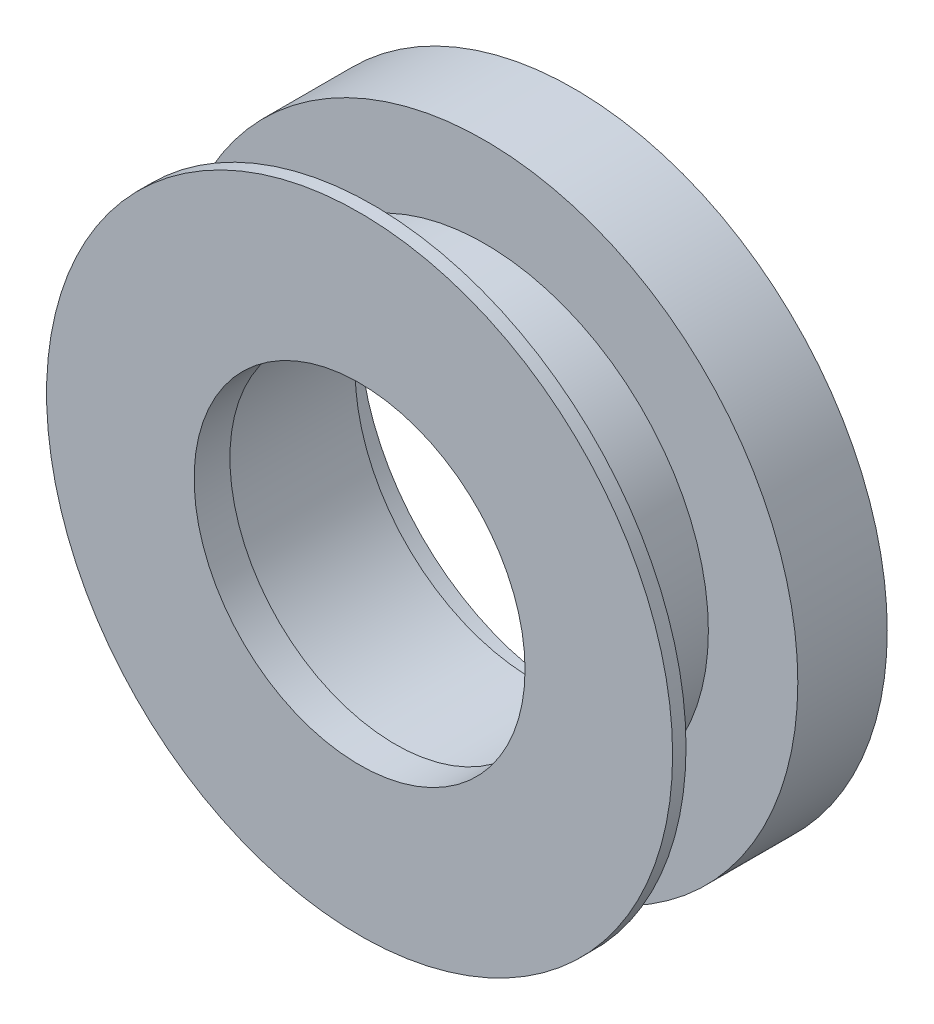
from build123d import *

# Parameters (mm, degrees)
D10_PILOT_AND_M10X0P5_THREAD_ENVELOPE_START = -1
SKETCH1_R                                   = 5
SKETCH1_R_2                                 = 4
D10_PILOT_AND_M10X0P5_THREAD_ENVELOPE_DEPTH = 2
OUTER_RACE_INNER_SHOULDER_ID7P4_START       = 1
SKETCH2_R                                   = 5
SKETCH2_R_2                                 = 3.7
OUTER_RACE_INNER_SHOULDER_ID7P4_DEPTH       = 0.8
INBOARD_G10_RETENTION_FLANGE_H0P3_START     = 1.5
SKETCH3_R                                   = 7
SKETCH3_R_2                                 = 3.7
INBOARD_G10_RETENTION_FLANGE_H0P3_DEPTH     = 0.3
M14X0P5_BEARING_CAP_BOSS_START              = -2.1
SKETCH4_R                                   = 7
SKETCH4_R_2                                 = 4
M14X0P5_BEARING_CAP_BOSS_DEPTH              = 1.1
FLANGED_RACE_POCKET_D9P6_START              = -3
SKETCH5_R                                   = 7
SKETCH5_R_2                                 = 4.8
FLANGED_RACE_POCKET_D9P6_DEPTH              = 0.9


with BuildPart() as part:
    # Sketch1 → D10_Pilot_And_M10x0p5_Thread_Envelope (new body)
    with BuildSketch(Plane.XY.offset(D10_PILOT_AND_M10X0P5_THREAD_ENVELOPE_START)):
        Circle(SKETCH1_R)
        Circle(SKETCH1_R_2, mode=Mode.SUBTRACT)
    extrude(amount=D10_PILOT_AND_M10X0P5_THREAD_ENVELOPE_DEPTH)

    # Sketch2 → Outer_Race_Inner_Shoulder_ID7p4 (add)
    with BuildSketch(Plane.XY.offset(OUTER_RACE_INNER_SHOULDER_ID7P4_START)):
        Circle(SKETCH2_R)
        Circle(SKETCH2_R_2, mode=Mode.SUBTRACT)
    extrude(amount=OUTER_RACE_INNER_SHOULDER_ID7P4_DEPTH)

    # Sketch3 → Inboard_G10_Retention_Flange_H0p3 (add)
    with BuildSketch(Plane.XY.offset(INBOARD_G10_RETENTION_FLANGE_H0P3_START)):
        Circle(SKETCH3_R)
        Circle(SKETCH3_R_2, mode=Mode.SUBTRACT)
    extrude(amount=INBOARD_G10_RETENTION_FLANGE_H0P3_DEPTH)

    # Sketch4 → M14x0p5_Bearing_Cap_Boss (add)
    with BuildSketch(Plane.XY.offset(M14X0P5_BEARING_CAP_BOSS_START)):
        Circle(SKETCH4_R)
        Circle(SKETCH4_R_2, mode=Mode.SUBTRACT)
    extrude(amount=M14X0P5_BEARING_CAP_BOSS_DEPTH)

    # Sketch5 → Flanged_Race_Pocket_D9p6 (add)
    with BuildSketch(Plane.XY.offset(FLANGED_RACE_POCKET_D9P6_START)):
        Circle(SKETCH5_R)
        Circle(SKETCH5_R_2, mode=Mode.SUBTRACT)
    extrude(amount=FLANGED_RACE_POCKET_D9P6_DEPTH)


solid = part.part
